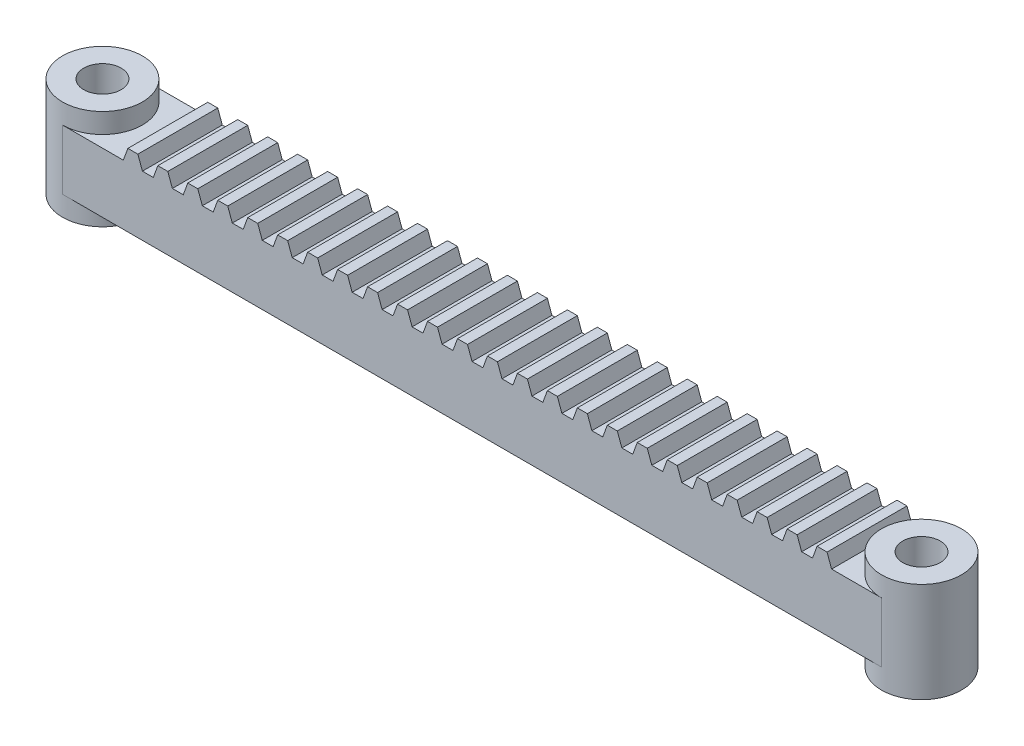
from build123d import *

# Parameters (mm, degrees)
SKETCH2_R             = 8
SKETCH2_R_2           = 3.75
BOSS_EXTRUDE1_DEPTH   = 20
BOSS_EXTRUDE1_2_DEPTH = 20
BOSS_EXTRUDE2_START   = 4
BOSS_EXTRUDE2_DEPTH   = 12
BOSS_EXTRUDE3_DEPTH   = 16


with BuildPart() as part:
    # Sketch2 → Boss-Extrude1 (new body)
    with BuildSketch(Plane(origin=(0, 0, 0), x_dir=(1, 0, 0), z_dir=(0, 1, 0))):
        with Locations(Location((-82, 0, 0), (0, 0, 270))):
            Circle(SKETCH2_R)
        with Locations(Location((-82, 0, 0), (0, 0, 270))):
            Circle(SKETCH2_R_2, mode=Mode.SUBTRACT)
    extrude(amount=BOSS_EXTRUDE1_DEPTH)



with BuildPart() as body_2:
    # Sketch2 → Boss-Extrude1 2 (new body)
    with BuildSketch(Plane(origin=(0, 0, 0), x_dir=(1, 0, 0), z_dir=(0, 1, 0))):
        with Locations(Location((82, 0, 0), (0, 0, 270))):
            Circle(SKETCH2_R)
        with Locations(Location((82, 0, 0), (0, 0, 270))):
            Circle(SKETCH2_R_2, mode=Mode.SUBTRACT)
    extrude(amount=BOSS_EXTRUDE1_2_DEPTH)


with BuildPart() as part_1:
    add(part.part)

    add(body_2.part)  # Boss-Extrude2 merges body 2
    # Sketch2<3> → Boss-Extrude2 (add)
    with BuildSketch(Plane(origin=(0, 0, 0), x_dir=(1, 0, 0), z_dir=(0, 1, 0)).offset(BOSS_EXTRUDE2_START)):
        with BuildLine():
            ThreePointArc((-74, 0), (-76.343145751, -5.656854249), (-82, -8))
            Line((-82, -8), (82, -8))
            ThreePointArc((82, -8), (74, 0), (82, 8))
            Line((82, 8), (-82, 8))
            ThreePointArc((-82, 8), (-76.343145751, 5.656854249), (-74, 0))
        make_face()
    extrude(amount=BOSS_EXTRUDE2_DEPTH)

    # Sketch3 → Boss-Extrude3 (add)
    with BuildSketch(Plane.XY.offset(8)):
        Polygon((68.180148829, 16), (72, 16), (71.090074414, 18.5), (69.090074414, 18.5), align=None)
        Polygon((-69.819851171, 16), (-66, 16), (-66.909925586, 18.5), (-68.909925586, 18.5), align=None)
        Polygon((-63.819851171, 16), (-60, 16), (-60.909925586, 18.5), (-62.909925586, 18.5), align=None)
        Polygon((-57.819851171, 16), (-54, 16), (-54.909925586, 18.5), (-56.909925586, 18.5), align=None)
        Polygon((-51.819851171, 16), (-48, 16), (-48.909925586, 18.5), (-50.909925586, 18.5), align=None)
        Polygon((-45.819851171, 16), (-42, 16), (-42.909925586, 18.5), (-44.909925586, 18.5), align=None)
        Polygon((-39.819851171, 16), (-36, 16), (-36.909925586, 18.5), (-38.909925586, 18.5), align=None)
        Polygon((-33.819851171, 16), (-30, 16), (-30.909925586, 18.5), (-32.909925586, 18.5), align=None)
        Polygon((-27.819851171, 16), (-24, 16), (-24.909925586, 18.5), (-26.909925586, 18.5), align=None)
        Polygon((-21.819851171, 16), (-18, 16), (-18.909925586, 18.5), (-20.909925586, 18.5), align=None)
        Polygon((-15.819851171, 16), (-12, 16), (-12.909925586, 18.5), (-14.909925586, 18.5), align=None)
        Polygon((-9.819851171, 16), (-6, 16), (-6.909925586, 18.5), (-8.909925586, 18.5), align=None)
        Polygon((-3.819851171, 16), (0, 16), (-0.909925586, 18.5), (-2.909925586, 18.5), align=None)
        Polygon((2.180148829, 16), (6, 16), (5.090074414, 18.5), (3.090074414, 18.5), align=None)
        Polygon((8.180148829, 16), (12, 16), (11.090074414, 18.5), (9.090074414, 18.5), align=None)
        Polygon((14.180148829, 16), (18, 16), (17.090074414, 18.5), (15.090074414, 18.5), align=None)
        Polygon((20.180148829, 16), (24, 16), (23.090074414, 18.5), (21.090074414, 18.5), align=None)
        Polygon((26.180148829, 16), (30, 16), (29.090074414, 18.5), (27.090074414, 18.5), align=None)
        Polygon((32.180148829, 16), (36, 16), (35.090074414, 18.5), (33.090074414, 18.5), align=None)
        Polygon((38.180148829, 16), (42, 16), (41.090074414, 18.5), (39.090074414, 18.5), align=None)
        Polygon((44.180148829, 16), (48, 16), (47.090074414, 18.5), (45.090074414, 18.5), align=None)
        Polygon((50.180148829, 16), (54, 16), (53.090074414, 18.5), (51.090074414, 18.5), align=None)
        Polygon((56.180148829, 16), (60, 16), (59.090074414, 18.5), (57.090074414, 18.5), align=None)
        Polygon((62.180148829, 16), (66, 16), (65.090074414, 18.5), (63.090074414, 18.5), align=None)
    extrude(amount=-BOSS_EXTRUDE3_DEPTH)


solid = part_1.part
